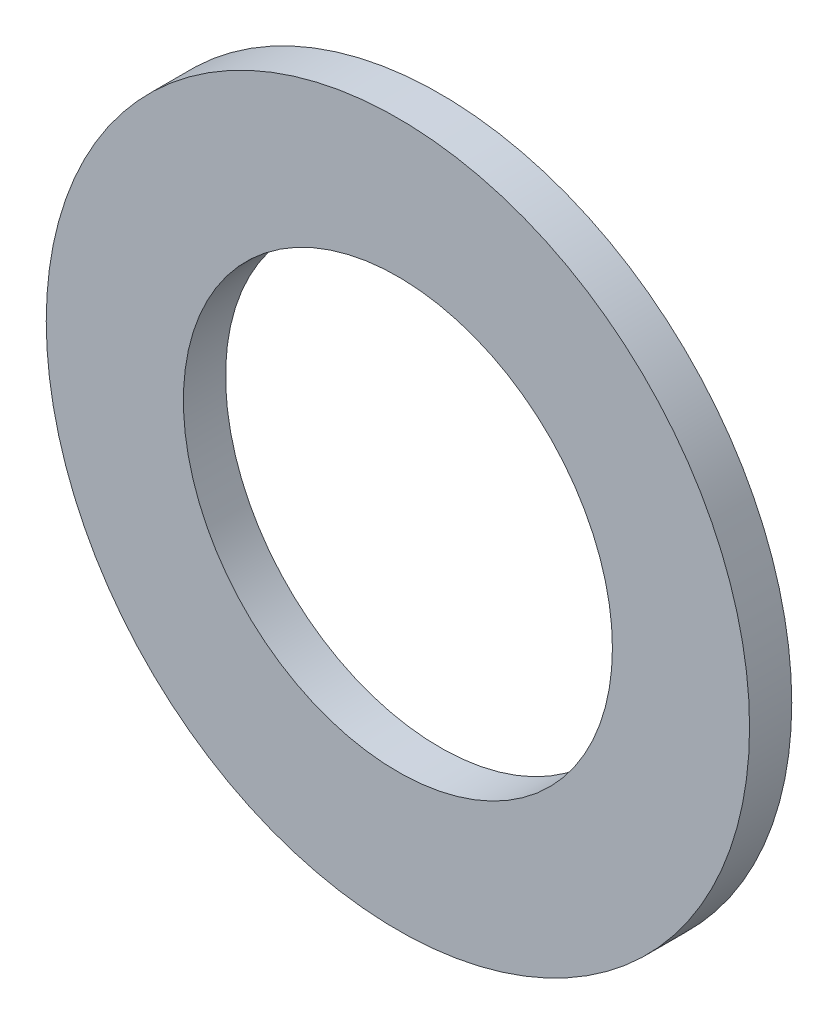
from build123d import *

# Parameters (mm, degrees)
SKETCH1_W = 6
SKETCH1_H = 19.5


with BuildPart() as part:
    # Sketch1 → Revolve1 (revolve)
    with BuildSketch(Plane(origin=(0, 0, 0), x_dir=(0, 0, -1), z_dir=(1, 0, 0)), mode=Mode.PRIVATE) as revolve1_sk:
        with Locations((3, 40.25)):
            Rectangle(SKETCH1_W, SKETCH1_H)
    revolve(revolve1_sk.sketch.rotate(Axis((0, 0, 0), (0, 0, -1)), 90), axis=Axis((0, 0, 0), (0, 0, -1)))


solid = part.part
